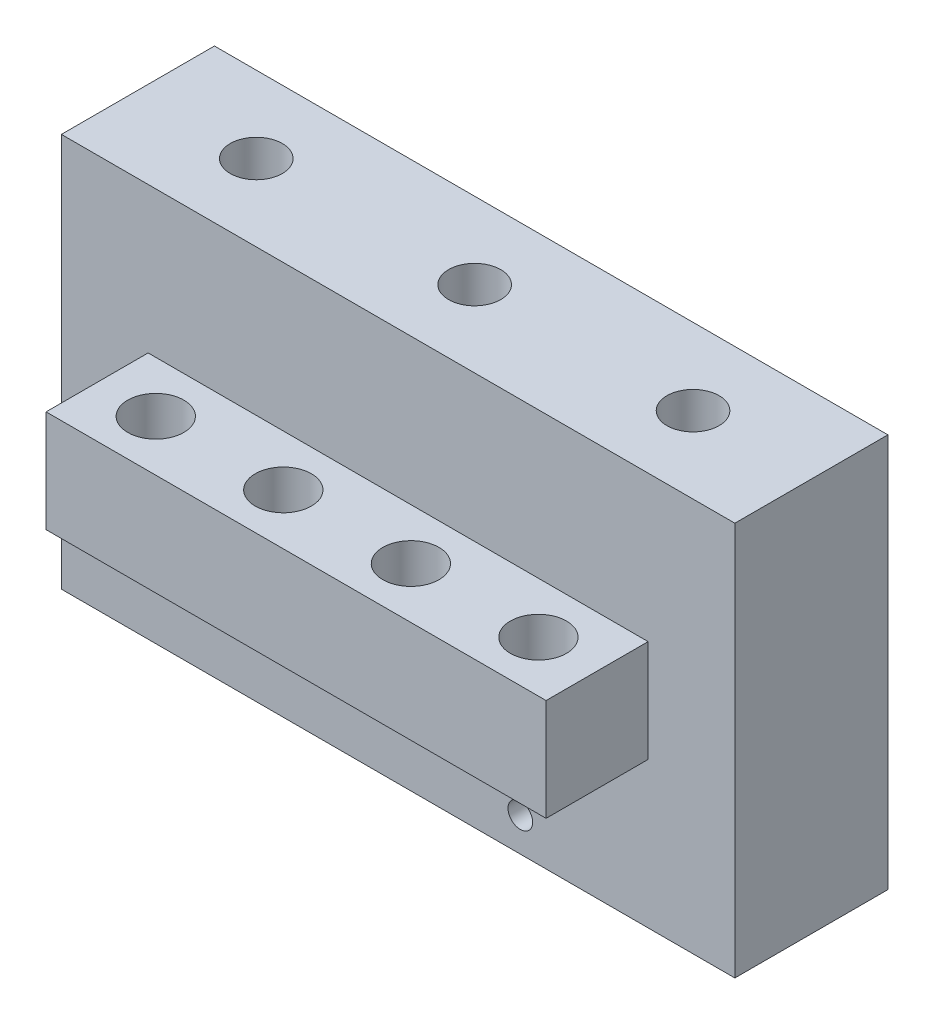
from build123d import *

# Parameters (mm, degrees)
SKETCH1_W                         = 49
SKETCH1_H                         = 10
BOSS_EXTRUDE1_DEPTH               = 10
SKETCH2_R                         = 2.75
CUT_EXTRUDE1_DEPTH                = 29.28869032
SKETCH3_W                         = 66
SKETCH3_H                         = 25
BOSS_EXTRUDE2_DEPTH               = 15
SKETCH11_W                        = 66
SKETCH11_H                        = 6.800000001
SKETCH11_H_2                      = 6.799999999
BOSS_EXTRUDE3_DEPTH               = 15
F_1_4_20_TAPPED_HOLE1_D           = 5.1054
F_1_4_20_TAPPED_HOLE2_D           = 5.1054
SKETCH17_RX                       = 1.2065
SKETCH17_RY                       = 1.205867042
TORSIONAL_SPRING_MOUNT_HOLE_DEPTH = 49.005103895


with BuildPart() as part:
    # Sketch1 → Boss-Extrude1 (new body)
    with BuildSketch(Plane(origin=(0, 0, 0), x_dir=(1, 0, 0), z_dir=(0, 1, 0))):
        with Locations((0, 5)):
            Rectangle(SKETCH1_W, SKETCH1_H)
    extrude(amount=BOSS_EXTRUDE1_DEPTH)

    # Sketch2 → Cut-Extrude1 (cut, through all)
    with BuildSketch(Plane(origin=(0, 10, 0), x_dir=(1, 0, 0), z_dir=(0, 1, 0))):
        with Locations(Location((-18.75, 5, 0), (0, 0, 270))):
            Circle(SKETCH2_R)
        with Locations(Location((-6.25, 5, 0), (0, 0, 270))):
            Circle(SKETCH2_R)
        with Locations(Location((6.25, 5, 0), (0, 0, 270))):
            Circle(SKETCH2_R)
        with Locations(Location((18.75, 5, 0), (0, 0, 270))):
            Circle(SKETCH2_R)
    extrude(amount=-CUT_EXTRUDE1_DEPTH, mode=Mode.SUBTRACT)

    # Sketch3 → Boss-Extrude2 (add)
    with BuildSketch(Plane(origin=(0, 0, -10), x_dir=(-1, 0, 0), z_dir=(0, 0, -1))):
        with Locations((0, 5)):
            Rectangle(SKETCH3_W, SKETCH3_H)
    extrude(amount=BOSS_EXTRUDE2_DEPTH)

    # Sketch11 → Boss-Extrude3 (add)
    with BuildSketch(Plane(origin=(0, 0, -25), x_dir=(-1, 0, 0), z_dir=(0, 0, -1))):
        with Locations((0, -10.900000001)):
            Rectangle(SKETCH11_W, SKETCH11_H)
        with Locations((0, 20.9)):
            Rectangle(SKETCH11_W, SKETCH11_H_2)
    extrude(amount=-BOSS_EXTRUDE3_DEPTH)

    # 1/4-20 Tapped Hole1 (through all)
    with Locations(Plane(origin=(0, -14.300000001, 0), x_dir=(-1, 0, 0), z_dir=(0, -1, 0))):
        with Locations((0, 17.5)):
            Hole(F_1_4_20_TAPPED_HOLE1_D / 2)

    # 1/4-20 Tapped Hole2 (through all)
    with Locations(Plane(origin=(0, -14.300000001, 0), x_dir=(-1, 0, 0), z_dir=(0, -1, 0))):
        with Locations((21.4, 17.5), (-21.4, 17.5)):
            Hole(F_1_4_20_TAPPED_HOLE2_D / 2)

    # Sketch17 → Torsional Spring Mount Hole (cut, through all)
    with BuildSketch(Plane(origin=(0, 0, -25), x_dir=(-1, 0, 0), z_dir=(0, 0, -1))):
        with Locations((-11.9761, -11.000000001)):
            Ellipse(SKETCH17_RX, SKETCH17_RY)
    extrude(amount=-TORSIONAL_SPRING_MOUNT_HOLE_DEPTH, mode=Mode.SUBTRACT)


solid = part.part
